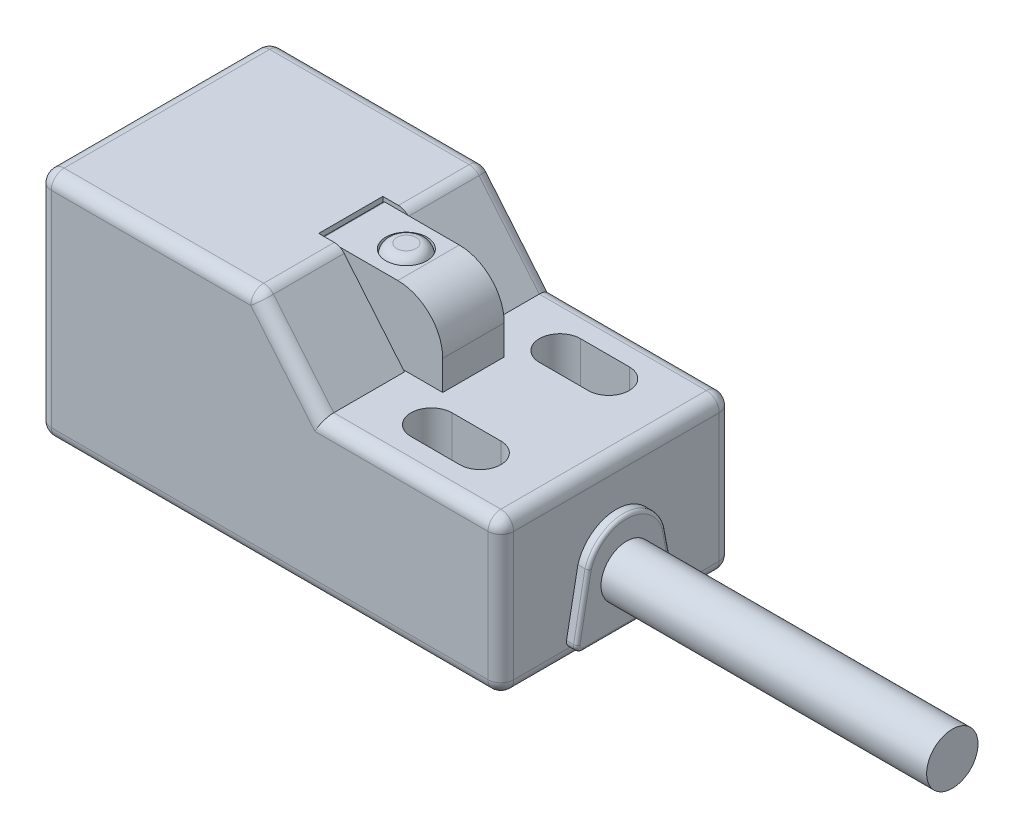
from build123d import *

# Parameters (mm, degrees)
RESSALTO_EXTRUS_O1_DEPTH = 18
CORTE_EXTRUS_O1_DEPTH    = 18
ESBO_O3_W                = 9.5
ESBO_O3_H                = 4.994016758
CORTE_EXTRUS_O2_DEPTH    = 8.8
ESBO_O4_W                = 9.445463152
ESBO_O4_H                = 4.78789149
RESSALTO_EXTRUS_O4_DEPTH = 5.8
FILETE1_R                = 0.15
FILETE2_R                = 3.5
ESBO_O8_R                = 1.6
CORTE_EXTRUS_O3_DEPTH    = 13
ESBO_O9_R                = 1.55
RESSALTO_EXTRUS_O6_DEPTH = 6.2
FILETE5_R                = 0.8
FILETE6_R                = 1
RESSALTO_EXTRUS_O7_DEPTH = 0.8
FILETE7_R                = 0.25
ESBO_O11_R               = 6.734780487
CORTE_EXTRUS_O4_DEPTH    = 0.35
FILETE8_R                = 0.1
ESBO_O12_R               = 2
RESSALTO_EXTRUS_O8_DEPTH = 25.35


with BuildPart() as part:
    # Esboço1 → Ressalto-extrusão1 (new body)
    with BuildSketch(Plane.XY):
        Polygon((-1, 9), (3.995203284, 3), (18, 3), (18, -9), (-18, -9), (-18, 9), align=None)
    extrude(amount=RESSALTO_EXTRUS_O1_DEPTH)

    # Esboço2 → Corte-extrusão1 (cut)
    with BuildSketch(Plane(origin=(0, 3, 0), x_dir=(1, 0, 0), z_dir=(0, 1, 0))):
        with BuildLine():
            Line((8.6, -2.4), (12.4, -2.4))
            ThreePointArc((12.4, -2.4), (14, -4), (12.4, -5.6))
            Line((12.4, -5.6), (8.6, -5.6))
            ThreePointArc((8.6, -5.6), (7, -4), (8.6, -2.4))
        make_face()
        with BuildLine():
            Line((8.6, -12.4), (12.4, -12.4))
            ThreePointArc((12.4, -12.4), (14, -14), (12.4, -15.6))
            Line((12.4, -15.6), (8.6, -15.6))
            ThreePointArc((8.6, -15.6), (7, -14), (8.6, -12.4))
        make_face()
    extrude(amount=-CORTE_EXTRUS_O1_DEPTH, mode=Mode.SUBTRACT)

    # Esboço3 → Corte-extrusão2 (cut)
    with BuildSketch(Plane(origin=(0, 3, 0), x_dir=(1, 0, 0), z_dir=(0, 1, 0))):
        with Locations((2.063909774, -9)):
            Rectangle(ESBO_O3_W, ESBO_O3_H)
    extrude(amount=CORTE_EXTRUS_O2_DEPTH, mode=Mode.SUBTRACT)

    # Esboço4 → Ressalto-extrusão4 (add)
    with BuildSketch(Plane(origin=(0, 3, 0), x_dir=(1, 0, 0), z_dir=(0, 1, 0))):
        with Locations((2.147704218, -9)):
            Rectangle(ESBO_O4_W, ESBO_O4_H)
    extrude(amount=RESSALTO_EXTRUS_O4_DEPTH)

    # Filete1
    filete1_edges = [part.edges().sort_by_distance(p)[0] for p in [
        (-2.575027358, 8.8, 9),
    ]]
    fillet(filete1_edges, radius=FILETE1_R)

    # Filete2
    filete2_edges = [part.edges().sort_by_distance(p)[0] for p in [
        (6.870435794, 8.8, 9),
    ]]
    fillet(filete2_edges, radius=FILETE2_R)

    # Esboço8 → Corte-extrusão3 (cut)
    with BuildSketch(Plane(origin=(0, 3, 0), x_dir=(1, 0, 0), z_dir=(0, 1, 0))):
        with Locations(Location((1.574972642, -8.929262573, 0), (0, 0, 90))):
            Circle(ESBO_O8_R)
    extrude(amount=CORTE_EXTRUS_O3_DEPTH, mode=Mode.SUBTRACT)

    # Esboço9 → Ressalto-extrusão6 (add)
    with BuildSketch(Plane(origin=(0, 3, 0), x_dir=(1, 0, 0), z_dir=(0, 1, 0))):
        with Locations(Location((1.574972642, -8.929262573, 0), (0, 0, 90))):
            Circle(ESBO_O9_R)
    extrude(amount=RESSALTO_EXTRUS_O6_DEPTH)

    # Filete5
    filete5_edges = [part.edges().sort_by_distance(p)[0] for p in [
        (1.574972642, 9.2, 10.479262573),
    ]]
    fillet(filete5_edges, radius=FILETE5_R)

    # Filete6
    filete6_edges = [part.edges().sort_by_distance(p)[0] for p in [
        (18, 3, 9),
        (18, -9, 9),
        (-18, -9, 9),
        (-18, 9, 9),
        (-1, 9, 14.74850419),
        (-18, 0, 18),
        (0, -9, 18),
        (18, -3, 18),
        (10.997601642, 3, 18),
        (1.497601642, 6, 18),
        (-1, 9, 3.25149581),
        (10.997601642, 3, 0),
        (18, -3, 0),
        (0, -9, 0),
        (-18, 0, 0),
        (-9.5, 9, 18),
        (-9.5, 9, 0),
        (1.497601642, 6, 0),
    ]]
    fillet(filete6_edges, radius=FILETE6_R)

    # Esboço10 → Ressalto-extrusão7 (add)
    with BuildSketch(Plane(origin=(18, 0, 0), x_dir=(0, 0, -1), z_dir=(1, 0, 0))):
        with BuildLine():
            Line((-12.395971593, -8), (-5.604028407, -8))
            ThreePointArc((-5.604028407, -8), (-5.218867086, -7.818827158), (-5.11282885, -7.406603027))
            Line((-5.11282885, -7.406603027), (-6, -2.74073365))
            ThreePointArc((-6, -2.74073365), (-9, -0.505491889), (-12, -2.74073365))
            Line((-12, -2.74073365), (-12.88717115, -7.406603027))
            ThreePointArc((-12.88717115, -7.406603027), (-12.781132914, -7.818827158), (-12.395971593, -8))
        make_face()
    extrude(amount=RESSALTO_EXTRUS_O7_DEPTH)

    # Filete7
    filete7_edges = [part.edges().sort_by_distance(p)[0] for p in [
        (18.8, -7.818827158, 12.781132914),
        (18.8, -8, 9),
        (18.8, -7.818827158, 5.218867086),
        (18.8, -5.073668339, 5.556414425),
        (18.8, -0.505491889, 9),
        (18.8, -5.073668339, 12.443585575),
    ]]
    fillet(filete7_edges, radius=FILETE7_R)

    # Esboço11 → Corte-extrusão4 (cut)
    with BuildSketch(Plane.ZY.offset(18)):
        with Locations((9, 0)):
            Circle(ESBO_O11_R)
        with BuildLine():
            Line((8.325, -3.799831968), (8.325, -5.493466122))
            ThreePointArc((8.325, -5.493466122), (5.085823531, -3.913185097), (3.50636307, -0.673608432))
            Line((3.50636307, -0.673608432), (5.199921098, -0.673608432))
            ThreePointArc((5.199921098, -0.673608432), (6.270549287, -2.728451354), (8.325, -3.799831968))
        make_face(mode=Mode.SUBTRACT)
        with BuildLine():
            Line((8.325, -0.673608432), (8.325, -2.532124718))
            ThreePointArc((8.325, -2.532124718), (7.146482489, -1.852499237), (6.467504735, -0.673608432))
            Line((6.467504735, -0.673608432), (8.325, -0.673608432))
        make_face(mode=Mode.SUBTRACT)
        with BuildLine():
            ThreePointArc((14.49363693, -0.673608432), (12.914176469, -3.913185097), (9.675, -5.493466122))
            Line((9.675, -5.493466122), (9.675, -3.799831968))
            ThreePointArc((9.675, -3.799831968), (11.729450713, -2.728451354), (12.800078902, -0.673608432))
            Line((12.800078902, -0.673608432), (14.49363693, -0.673608432))
        make_face(mode=Mode.SUBTRACT)
        with BuildLine():
            ThreePointArc((11.532495265, -0.673608432), (10.853517511, -1.852499237), (9.675, -2.532124718))
            Line((9.675, -2.532124718), (9.675, -0.673608432))
            Line((9.675, -0.673608432), (11.532495265, -0.673608432))
        make_face(mode=Mode.SUBTRACT)
        with BuildLine():
            Line((8.325, 0.673608432), (6.467504735, 0.673608432))
            ThreePointArc((6.467504735, 0.673608432), (7.146482489, 1.852499237), (8.325, 2.532124718))
            Line((8.325, 2.532124718), (8.325, 0.673608432))
        make_face(mode=Mode.SUBTRACT)
        with BuildLine():
            Line((5.199921098, 0.673608432), (3.50636307, 0.673608432))
            ThreePointArc((3.50636307, 0.673608432), (5.085823531, 3.913185097), (8.325, 5.493466122))
            Line((8.325, 5.493466122), (8.325, 3.799831968))
            ThreePointArc((8.325, 3.799831968), (6.270549287, 2.728451354), (5.199921098, 0.673608432))
        make_face(mode=Mode.SUBTRACT)
        with BuildLine():
            Line((11.532495265, 0.673608432), (9.675, 0.673608432))
            Line((9.675, 0.673608432), (9.675, 2.532124718))
            ThreePointArc((9.675, 2.532124718), (10.853517511, 1.852499237), (11.532495265, 0.673608432))
        make_face(mode=Mode.SUBTRACT)
        with BuildLine():
            ThreePointArc((12.800078902, 0.673608432), (11.729450713, 2.728451354), (9.675, 3.799831968))
            Line((9.675, 3.799831968), (9.675, 5.493466122))
            ThreePointArc((9.675, 5.493466122), (12.914176469, 3.913185097), (14.49363693, 0.673608432))
            Line((14.49363693, 0.673608432), (12.800078902, 0.673608432))
        make_face(mode=Mode.SUBTRACT)
    extrude(amount=-CORTE_EXTRUS_O4_DEPTH, mode=Mode.SUBTRACT)

    # Filete8
    filete8_edges = [part.edges().sort_by_distance(p)[0] for p in [
        (-18, -3.913185097, 12.914176469),
        (-18, 1.852499237, 7.146482489),
        (-18, 0.673608432, 7.396252368),
        (-18, 3.913185097, 5.085823531),
        (-18, 0.673608432, 4.353142084),
        (-18, -1.852499237, 10.853517511),
        (-18, 1.852499237, 10.853517511),
        (-18, -1.852499237, 7.146482489),
        (-18, -1.602866575, 8.325),
        (-18, -3.913185097, 5.085823531),
        (-18, -4.646649045, 8.325),
        (-18, 3.913185097, 12.914176469),
        (-18, 1.602866575, 8.325),
        (-18, 4.646649045, 8.325),
        (-18, 0.673608432, 10.603747632),
        (-18, 0.673608432, 13.646857916),
        (-18, 2.728451354, 11.729450713),
        (-18, 4.646649045, 9.675),
        (-18, -0.673608432, 4.353142084),
        (-18, -2.728451354, 6.270549287),
        (-18, -0.673608432, 7.396252368),
        (-18, 1.602866575, 9.675),
        (-18, -1.602866575, 9.675),
        (-18, -0.673608432, 10.603747632),
        (-18, 2.728451354, 6.270549287),
        (-18, 0, 2.265219513),
        (-18, -4.646649045, 9.675),
        (-18, -2.728451354, 11.729450713),
        (-18, -0.673608432, 13.646857916),
    ]]
    fillet(filete8_edges, radius=FILETE8_R)

    # Esboço12 → Ressalto-extrusão8 (add)
    with BuildSketch(Plane(origin=(18.8, 0, 0), x_dir=(0, 0, -1), z_dir=(1, 0, 0))):
        with Locations((-9, -4.252745945)):
            Circle(ESBO_O12_R)
    extrude(amount=RESSALTO_EXTRUS_O8_DEPTH)


solid = part.part
